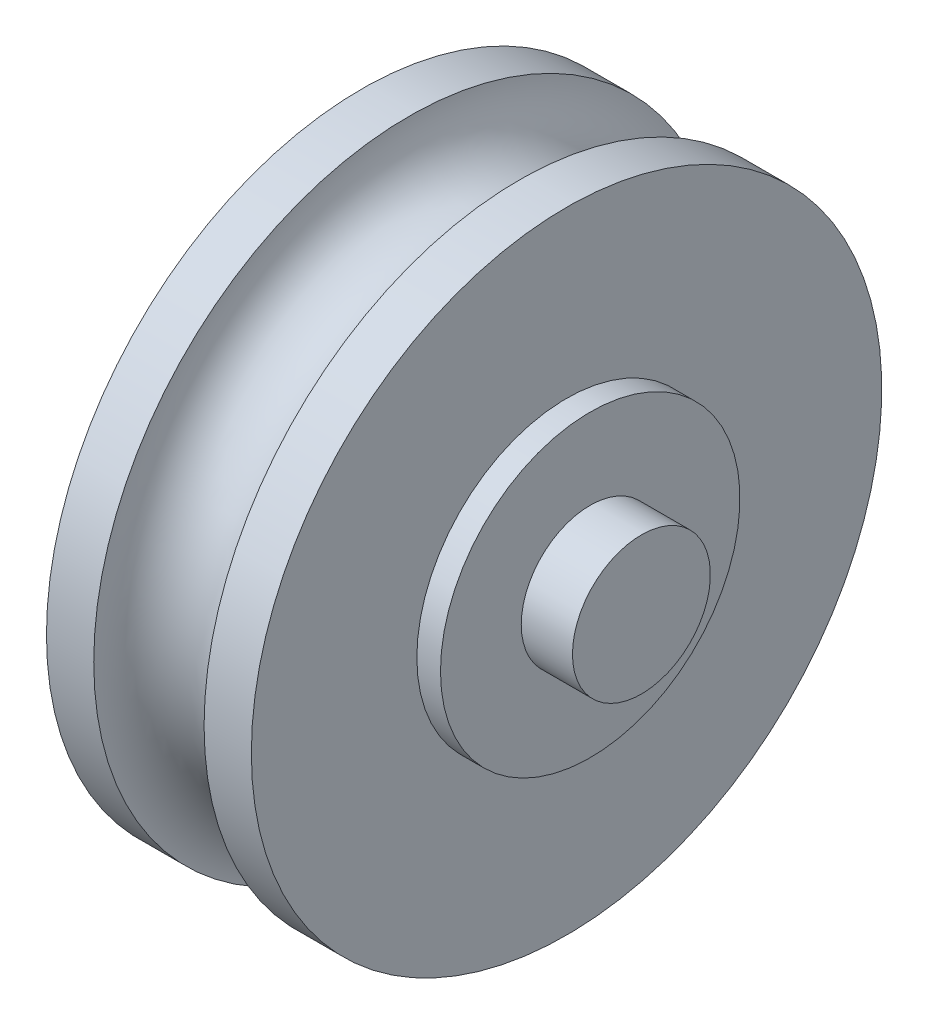
from build123d import *


with BuildPart() as part:
    # Sketch1 → Revolve1 (revolve)
    with BuildSketch(Plane.XY, mode=Mode.PRIVATE) as revolve1_sk:
        with BuildLine():
            Line((2.6, 3.8), (2.6, 8))
            Line((2.6, 8), (1.4, 8))
            ThreePointArc((1.4, 8), (0, 6.6), (-1.4, 8))
            Line((-1.4, 8), (-2.6, 8))
            Line((-2.6, 8), (-2.6, 3.8))
            Line((-2.6, 3.8), (-3.2, 3.8))
            Line((-3.2, 3.8), (-3.2, 1.75))
            Line((-3.2, 1.75), (-4.5, 1.75))
            Line((-4.5, 1.75), (-4.5, 0))
            Line((-4.5, 0), (4.5, 0))
            Line((4.5, 0), (4.5, 1.75))
            Line((4.5, 1.75), (3.2, 1.75))
            Line((3.2, 1.75), (3.2, 3.8))
            Line((3.2, 3.8), (2.6, 3.8))
        make_face()
    revolve(revolve1_sk.sketch.rotate(Axis((0, 0, 0), (1, 0, 0)), 90), axis=Axis((0, 0, 0), (1, 0, 0)))


solid = part.part
